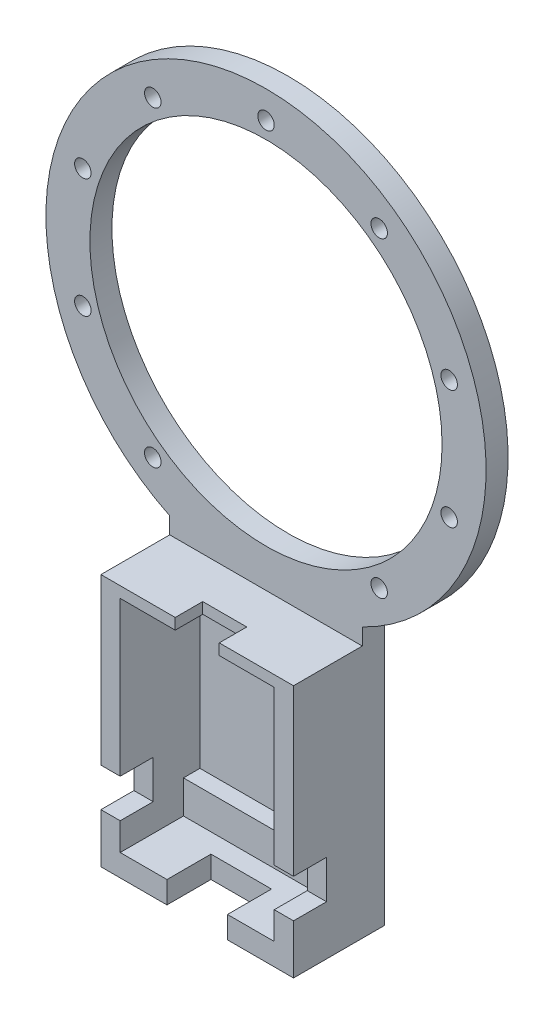
from build123d import *

# Parameters (mm, degrees)
SKETCH1_R             = 1.5
SKETCH1_R_2           = 32
BOSS_EXTRUDE1_DEPTH   = 4
SKETCH1_3_R           = 4
BOSS_EXTRUDE2_DEPTH   = 2
SKETCH1_11_W          = 28
SKETCH1_11_H          = 6
BOSS_EXTRUDE4_DEPTH   = 5
SKETCH1_11_W_2        = 3
SKETCH1_11_H_2        = 3
BOSS_EXTRUDE4_2_DEPTH = 5
BOSS_EXTRUDE4_3_DEPTH = 5
SKETCH1_21_W          = 35
SKETCH1_21_H          = 46
BOSS_EXTRUDE7_DEPTH   = 16.5
SKETCH3_W             = 6
SKETCH3_H             = 7
CUT_EXTRUDE1_DEPTH    = 35.5
SKETCH4_W             = 11
SKETCH4_H             = 8
CUT_EXTRUDE2_DEPTH    = 4
SKETCH5_W             = 8
SKETCH5_H             = 5
CUT_EXTRUDE3_DEPTH    = 52


with BuildPart() as part:
    # Sketch1 → Boss-Extrude1 (new body)
    with BuildSketch(Plane.XY):
        with BuildLine():
            Line((-17.5, -38.96998799), (17.5, -38.96998799))
            Line((17.5, -38.96998799), (17.5, -35.968736425))
            ThreePointArc((17.5, -35.968736425), (0, 40), (-17.5, -35.968736425))
            Line((-17.5, -35.968736425), (-17.5, -38.96998799))
        make_face()
        with Locations((-20.57248383, -28.315594803)):
            Circle(SKETCH1_R, mode=Mode.SUBTRACT)
        with Locations((20.57248383, -28.315594803)):
            Circle(SKETCH1_R, mode=Mode.SUBTRACT)
        with Locations((-33.28697807, -10.815594803)):
            Circle(SKETCH1_R, mode=Mode.SUBTRACT)
        Circle(SKETCH1_R_2, mode=Mode.SUBTRACT)
        with Locations((-33.28697807, 10.815594803)):
            Circle(SKETCH1_R, mode=Mode.SUBTRACT)
        with Locations((-20.57248383, 28.315594803)):
            Circle(SKETCH1_R, mode=Mode.SUBTRACT)
        with Locations((0, 35)):
            Circle(SKETCH1_R, mode=Mode.SUBTRACT)
        with Locations((33.28697807, -10.815594803)):
            Circle(SKETCH1_R, mode=Mode.SUBTRACT)
        with Locations((33.28697807, 10.815594803)):
            Circle(SKETCH1_R, mode=Mode.SUBTRACT)
        with Locations((20.57248383, 28.315594803)):
            Circle(SKETCH1_R, mode=Mode.SUBTRACT)
    extrude(amount=BOSS_EXTRUDE1_DEPTH)



with BuildPart() as body_2:
    # Sketch1<3> → Boss-Extrude2 (new body)
    with BuildSketch(Plane.XY):
        Polygon((11, -40.96998799), (-11, -40.96998799), (-11, -43.96998799), (-14, -43.96998799), (-14, -74.96998799), (14, -74.96998799), (14, -43.96998799), (11, -43.96998799), align=None)
        with Locations((0, -50.96998799)):
            Circle(SKETCH1_3_R, mode=Mode.SUBTRACT)
    extrude(amount=BOSS_EXTRUDE2_DEPTH)


with BuildPart() as body_3:
    # Sketch1<11> → Boss-Extrude4 (new body)
    with BuildSketch(Plane.XY):
        with Locations((0, -77.96998799)):
            Rectangle(SKETCH1_11_W, SKETCH1_11_H)
    extrude(amount=BOSS_EXTRUDE4_DEPTH)


with BuildPart() as body_4:
    # Sketch1<11> → Boss-Extrude4 2 (new body)
    with BuildSketch(Plane.XY):
        with Locations((-12.5, -42.46998799)):
            Rectangle(SKETCH1_11_W_2, SKETCH1_11_H_2)
    extrude(amount=BOSS_EXTRUDE4_2_DEPTH)


with BuildPart() as body_5:
    # Sketch1<11> → Boss-Extrude4 3 (new body)
    with BuildSketch(Plane.XY):
        with Locations((12.5, -42.46998799)):
            Rectangle(SKETCH1_11_W_2, SKETCH1_11_H_2)
    extrude(amount=BOSS_EXTRUDE4_3_DEPTH)


with BuildPart() as part_1:
    add(part.part)

    add(body_2.part)  # Boss-Extrude7 merges body 2

    add(body_3.part)  # Boss-Extrude7 merges body 3

    add(body_4.part)  # Boss-Extrude7 merges body 4

    add(body_5.part)  # Boss-Extrude7 merges body 5
    # Sketch1<21> → Boss-Extrude7 (add)
    with BuildSketch(Plane.XY):
        with Locations((0, -61.96998799)):
            Rectangle(SKETCH1_21_W, SKETCH1_21_H)
        Polygon((-14, -43.96998799), (-14, -40.96998799), (-11, -40.96998799), (11, -40.96998799), (14, -40.96998799), (14, -43.96998799), (14, -74.96998799), (14, -80.96998799), (-14, -80.96998799), (-14, -74.96998799), align=None, mode=Mode.SUBTRACT)
    extrude(amount=BOSS_EXTRUDE7_DEPTH)

    # Sketch3 → Cut-Extrude1 (cut)
    with BuildSketch(Plane(origin=(17.5, 0, 0), x_dir=(0, 0, -1), z_dir=(1, 0, 0))):
        with Locations((-13.5, -72.46998799)):
            Rectangle(SKETCH3_W, SKETCH3_H)
    extrude(amount=-CUT_EXTRUDE1_DEPTH, mode=Mode.SUBTRACT)

    # Sketch4 → Cut-Extrude2 (cut)
    with BuildSketch(Plane(origin=(0, -84.96998799, 0), x_dir=(-1, 0, 0), z_dir=(0, -1, 0))):
        with Locations((0, -12.5)):
            Rectangle(SKETCH4_W, SKETCH4_H)
    extrude(amount=-CUT_EXTRUDE2_DEPTH, mode=Mode.SUBTRACT)

    # Sketch5 → Cut-Extrude3 (cut)
    with BuildSketch(Plane(origin=(0, -84.96998799, 0), x_dir=(-1, 0, 0), z_dir=(0, -1, 0))):
        with Locations((0, -14)):
            Rectangle(SKETCH5_W, SKETCH5_H)
    extrude(amount=-CUT_EXTRUDE3_DEPTH, mode=Mode.SUBTRACT)


solid = part_1.part
